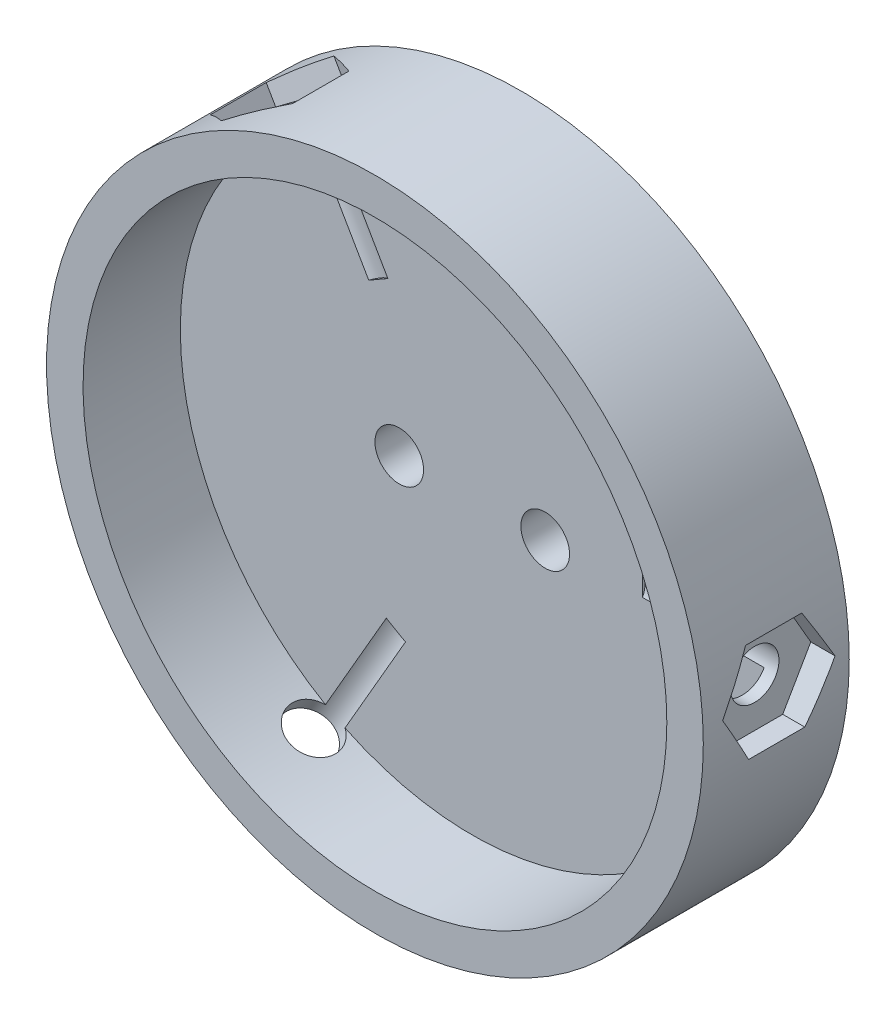
from build123d import *

# Parameters (mm, degrees)
SKETCH1_R                   = 13.5
BOSS_EXTRUDE1_DEPTH         = 2
SKETCH2_R                   = 13.5
SKETCH2_R_2                 = 12
BOSS_EXTRUDE2_DEPTH         = 4
SKETCH4_R                   = 1
CUT_EXTRUDE1_DEPTH          = 13
SKETCH4_3_R                 = 1
CUT_EXTRUDE2_DEPTH          = 7.5
CIRPATTERN1_COUNT           = 3
CIRPATTERN2_COUNT           = 3
CIRPATTERN2_COPY_1_SKETCH_R = 1
CIRPATTERN2_COPY_1_DEPTH    = 7.5
CIRPATTERN2_COPY_2_SKETCH_R = 1
CIRPATTERN2_COPY_2_DEPTH    = 7.5
CIRPATTERN2_COPY_3_SKETCH_R = 1
CIRPATTERN2_COPY_3_DEPTH    = 7.5
CIRPATTERN2_COPY_4_SKETCH_R = 1
CIRPATTERN2_COPY_4_DEPTH    = 7.5
CIRPATTERN2_COPY_5_SKETCH_R = 1
CIRPATTERN2_COPY_5_DEPTH    = 7.5
CIRPATTERN2_COPY_6_SKETCH_R = 1
CIRPATTERN2_COPY_6_DEPTH    = 7.5
SKETCH5_R                   = 1
CUT_EXTRUDE3_DEPTH          = 20.506409224


with BuildPart() as part:
    # Sketch1 → Boss-Extrude1 (new body)
    with BuildSketch(Plane.XY):
        Circle(SKETCH1_R)
    extrude(amount=BOSS_EXTRUDE1_DEPTH)

    # Sketch2 → Boss-Extrude2 (add)
    with BuildSketch(Plane.XY.offset(2)):
        Circle(SKETCH2_R)
        Circle(SKETCH2_R_2, mode=Mode.SUBTRACT)
    extrude(amount=BOSS_EXTRUDE2_DEPTH)

    # Sketch4 → Cut-Extrude1 (cut)
    with BuildSketch(Plane(origin=(20, 0, 0), x_dir=(0, 0, -1), z_dir=(1, 0, 0))):
        with Locations((-2.890598923, 0.416590766)):
            Circle(SKETCH4_R)
    cut_extrude1 = extrude(amount=-CUT_EXTRUDE1_DEPTH, mode=Mode.SUBTRACT)

    # Sketch4<3> → Cut-Extrude2 (cut)
    with BuildSketch(Plane(origin=(20, 0, 0), x_dir=(0, 0, -1), z_dir=(1, 0, 0))):
        Polygon((-0.581197846, 0.416590766), (-1.735898385, 2.416590766), (-4.045299462, 2.416590766), (-5.2, 0.416590766), (-4.045299462, -1.583409234), (-1.735898385, -1.583409234), align=None)
        with Locations((-2.890598923, 0.416590766)):
            Circle(SKETCH4_3_R, mode=Mode.SUBTRACT)
    cut_extrude2 = extrude(amount=-CUT_EXTRUDE2_DEPTH, mode=Mode.SUBTRACT)

    # CirPattern1: Cut-Extrude2 ×3 about axis
    cirpattern1_axis = Axis((0, 0, 2), (0, 0, -1))
    for i in range(1, CIRPATTERN1_COUNT):
        add(cut_extrude2.rotate(cirpattern1_axis, i * 360 / CIRPATTERN1_COUNT), mode=Mode.SUBTRACT)

    # CirPattern2: Cut-Extrude1 ×3 about axis
    cirpattern2_axis = Axis((0, 0, 2), (0, 0, -1))
    for i in range(1, CIRPATTERN2_COUNT):
        add(cut_extrude1.rotate(cirpattern2_axis, i * 360 / CIRPATTERN2_COUNT), mode=Mode.SUBTRACT)

    # CirPattern2 copy 1 sketch → CirPattern2 copy 1 (cut)
    with BuildSketch(Plane(origin=(-10, 17.320508076, 0), x_dir=(0, 0, -1), z_dir=(-0.5000000000000003, 0.8660254037844384, 0))):
        Polygon((-0.581197846, 0.416590766), (-1.735898385, 2.416590766), (-4.045299462, 2.416590766), (-5.2, 0.416590766), (-4.045299462, -1.583409234), (-1.735898385, -1.583409234), align=None)
        with Locations((-2.890598923, 0.416590766)):
            Circle(CIRPATTERN2_COPY_1_SKETCH_R, mode=Mode.SUBTRACT)
    extrude(amount=-CIRPATTERN2_COPY_1_DEPTH, mode=Mode.SUBTRACT)

    # CirPattern2 copy 2 sketch → CirPattern2 copy 2 (cut)
    with BuildSketch(Plane(origin=(20, 0, 0), x_dir=(0, 0, -1), z_dir=(1, 0, 0))):
        Polygon((-0.581197846, 0.416590766), (-1.735898385, 2.416590766), (-4.045299462, 2.416590766), (-5.2, 0.416590766), (-4.045299462, -1.583409234), (-1.735898385, -1.583409234), align=None)
        with Locations((-2.890598923, 0.416590766)):
            Circle(CIRPATTERN2_COPY_2_SKETCH_R, mode=Mode.SUBTRACT)
    extrude(amount=-CIRPATTERN2_COPY_2_DEPTH, mode=Mode.SUBTRACT)

    # CirPattern2 copy 3 sketch → CirPattern2 copy 3 (cut)
    with BuildSketch(Plane(origin=(20, 0, 0), x_dir=(0, 0, -1), z_dir=(1, 0, 0))):
        Polygon((-0.581197846, 0.416590766), (-1.735898385, 2.416590766), (-4.045299462, 2.416590766), (-5.2, 0.416590766), (-4.045299462, -1.583409234), (-1.735898385, -1.583409234), align=None)
        with Locations((-2.890598923, 0.416590766)):
            Circle(CIRPATTERN2_COPY_3_SKETCH_R, mode=Mode.SUBTRACT)
    extrude(amount=-CIRPATTERN2_COPY_3_DEPTH, mode=Mode.SUBTRACT)

    # CirPattern2 copy 4 sketch → CirPattern2 copy 4 (cut)
    with BuildSketch(Plane(origin=(-10, -17.320508076, 0), x_dir=(0, 0, -1), z_dir=(-0.4999999999999991, -0.8660254037844392, 0))):
        Polygon((-0.581197846, 0.416590766), (-1.735898385, 2.416590766), (-4.045299462, 2.416590766), (-5.2, 0.416590766), (-4.045299462, -1.583409234), (-1.735898385, -1.583409234), align=None)
        with Locations((-2.890598923, 0.416590766)):
            Circle(CIRPATTERN2_COPY_4_SKETCH_R, mode=Mode.SUBTRACT)
    extrude(amount=-CIRPATTERN2_COPY_4_DEPTH, mode=Mode.SUBTRACT)

    # CirPattern2 copy 5 sketch → CirPattern2 copy 5 (cut)
    with BuildSketch(Plane(origin=(-10, -17.320508076, 0), x_dir=(0, 0, -1), z_dir=(-0.4999999999999998, -0.8660254037844387, 0))):
        Polygon((-0.581197846, 0.416590766), (-1.735898385, 2.416590766), (-4.045299462, 2.416590766), (-5.2, 0.416590766), (-4.045299462, -1.583409234), (-1.735898385, -1.583409234), align=None)
        with Locations((-2.890598923, 0.416590766)):
            Circle(CIRPATTERN2_COPY_5_SKETCH_R, mode=Mode.SUBTRACT)
    extrude(amount=-CIRPATTERN2_COPY_5_DEPTH, mode=Mode.SUBTRACT)

    # CirPattern2 copy 6 sketch → CirPattern2 copy 6 (cut)
    with BuildSketch(Plane(origin=(-10, 17.320508076, 0), x_dir=(0, 0, -1), z_dir=(-0.5000000000000004, 0.8660254037844384, 0))):
        Polygon((-0.581197846, 0.416590766), (-1.735898385, 2.416590766), (-4.045299462, 2.416590766), (-5.2, 0.416590766), (-4.045299462, -1.583409234), (-1.735898385, -1.583409234), align=None)
        with Locations((-2.890598923, 0.416590766)):
            Circle(CIRPATTERN2_COPY_6_SKETCH_R, mode=Mode.SUBTRACT)
    extrude(amount=-CIRPATTERN2_COPY_6_DEPTH, mode=Mode.SUBTRACT)

    # Sketch5 → Cut-Extrude3 (cut, through all)
    with BuildSketch(Plane.XY.offset(2)):
        with Locations((3, 0)):
            Circle(SKETCH5_R)
        with Locations((-3, 0)):
            Circle(SKETCH5_R)
    extrude(amount=-CUT_EXTRUDE3_DEPTH, mode=Mode.SUBTRACT)


solid = part.part
